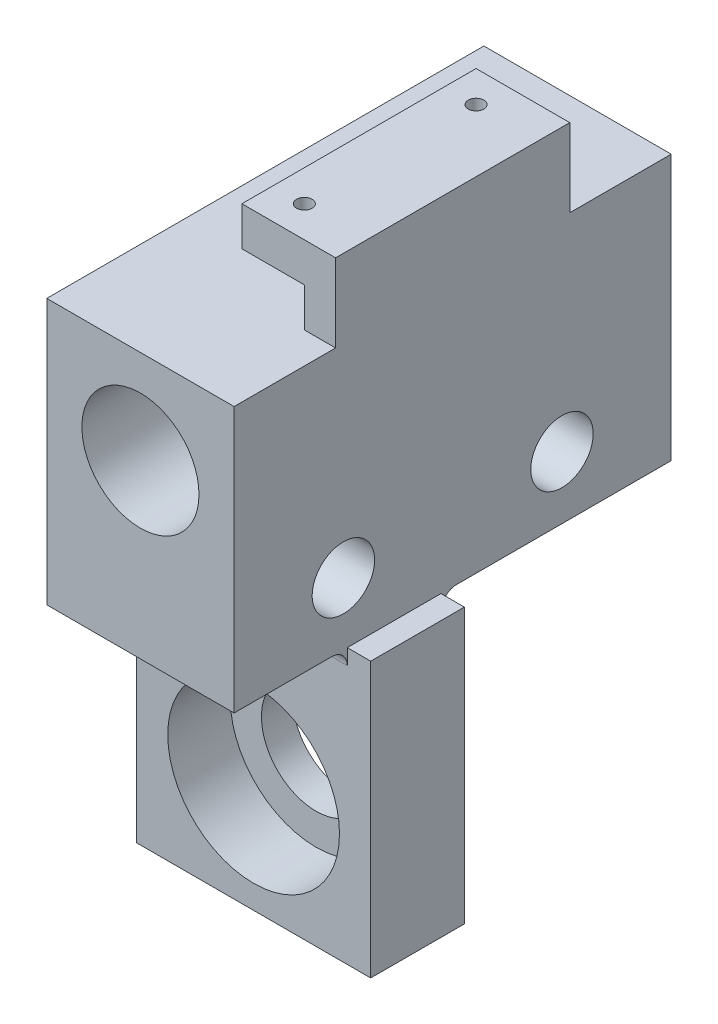
from build123d import *

# Parameters (mm, degrees)
SKETCH1_W           = 24
SKETCH1_H           = 34
SKETCH1_R           = 7.5
BOSS_EXTRUDE1_DEPTH = 28
SKETCH3_W           = 30
SKETCH3_H           = 12
BOSS_EXTRUDE2_DEPTH = 35.15
SKETCH4_R           = 11
CUT_EXTRUDE2_DEPTH  = 8
FILLET1_R           = 2
SKETCH5_W           = 12
SKETCH5_H           = 30
BOSS_EXTRUDE3_DEPTH = 10
SKETCH6_W           = 8
SKETCH6_H           = 5
CUT_EXTRUDE3_DEPTH  = 74.076141797
CUT_EXTRUDE4_REACH  = 87.286
SKETCH7_R           = 1
SKETCH8_R           = 4
CUT_EXTRUDE5_DEPTH  = 20
SKETCH9_R           = 7
CUT_EXTRUDE6_DEPTH  = 10


with BuildPart() as part:
    # Sketch1 → Boss-Extrude1 (new, symmetric)
    with BuildSketch(Plane.XY):
        with Locations((0, -5)):
            Rectangle(SKETCH1_W, SKETCH1_H)
        Circle(SKETCH1_R, mode=Mode.SUBTRACT)
    extrude(amount=BOSS_EXTRUDE1_DEPTH, both=True)

    # Sketch3 → Boss-Extrude2 (add)
    with BuildSketch(Plane.XZ.offset(22)):
        with Locations((0, 7.5)):
            Rectangle(SKETCH3_W, SKETCH3_H)
    extrude(amount=BOSS_EXTRUDE2_DEPTH)

    # Sketch4 → Cut-Extrude2 (cut)
    with BuildSketch(Plane.XY.offset(13.5)):
        with Locations((0, -43.15)):
            Circle(SKETCH4_R)
    extrude(amount=-CUT_EXTRUDE2_DEPTH, mode=Mode.SUBTRACT)

    # Fillet1
    fillet1_edges = [part.edges().sort_by_distance(p)[0] for p in [
        (0, -22, 1.5),
        (0, -22, 13.5),
    ]]
    fillet(fillet1_edges, radius=FILLET1_R)

    # Sketch5 → Boss-Extrude3 (add)
    with BuildSketch(Plane(origin=(0, 12, 0), x_dir=(1, 0, 0), z_dir=(0, 1, 0))):
        with Locations((6, 0)):
            Rectangle(SKETCH5_W, SKETCH5_H)
    extrude(amount=BOSS_EXTRUDE3_DEPTH)

    # Sketch6 → Cut-Extrude3 (cut, through all)
    with BuildSketch(Plane.XY.offset(15)):
        with Locations((4, 14.5)):
            Rectangle(SKETCH6_W, SKETCH6_H)
    extrude(amount=-CUT_EXTRUDE3_DEPTH, mode=Mode.SUBTRACT)

    # Sketch7 → Cut-Extrude4 (cut, up to next)
    with BuildSketch(Plane(origin=(0, 22, 0), x_dir=(1, 0, 0), z_dir=(0, 1, 0)), mode=Mode.PRIVATE) as cut_extrude4_sk1:
        with Locations(Location((4, 11, 0), (0, 0, 270))):
            Circle(SKETCH7_R)
    cut_extrude4_tool1 = extrude(cut_extrude4_sk1.sketch, amount=-CUT_EXTRUDE4_REACH, mode=Mode.PRIVATE) & part.part
    # Sketch7 → Cut-Extrude4 (cut, up to next)
    with BuildSketch(Plane(origin=(0, 22, 0), x_dir=(1, 0, 0), z_dir=(0, 1, 0)), mode=Mode.PRIVATE) as cut_extrude4_sk2:
        with Locations(Location((4, -11, 0), (0, 0, 270))):
            Circle(SKETCH7_R)
    cut_extrude4_tool2 = extrude(cut_extrude4_sk2.sketch, amount=-CUT_EXTRUDE4_REACH, mode=Mode.PRIVATE) & part.part
    add(cut_extrude4_tool1.solids().sort_by_distance((4, 22, -11))[0], mode=Mode.SUBTRACT)
    add(cut_extrude4_tool2.solids().sort_by_distance((4, 22, 11))[0], mode=Mode.SUBTRACT)

    # Sketch8 → Cut-Extrude5 (cut)
    with BuildSketch(Plane(origin=(12, 0, 0), x_dir=(0, 0, -1), z_dir=(1, 0, 0))):
        with Locations(Location((-14, -14, 0), (0, 0, 90))):
            Circle(SKETCH8_R)
        with Locations(Location((14, -14, 0), (0, 0, 90))):
            Circle(SKETCH8_R)
    extrude(amount=-CUT_EXTRUDE5_DEPTH, mode=Mode.SUBTRACT)

    # Sketch9 → Cut-Extrude6 (cut)
    with BuildSketch(Plane.XY.offset(5.5)):
        with Locations((0, -43.15)):
            Circle(SKETCH9_R)
    extrude(amount=-CUT_EXTRUDE6_DEPTH, mode=Mode.SUBTRACT)


solid = part.part
